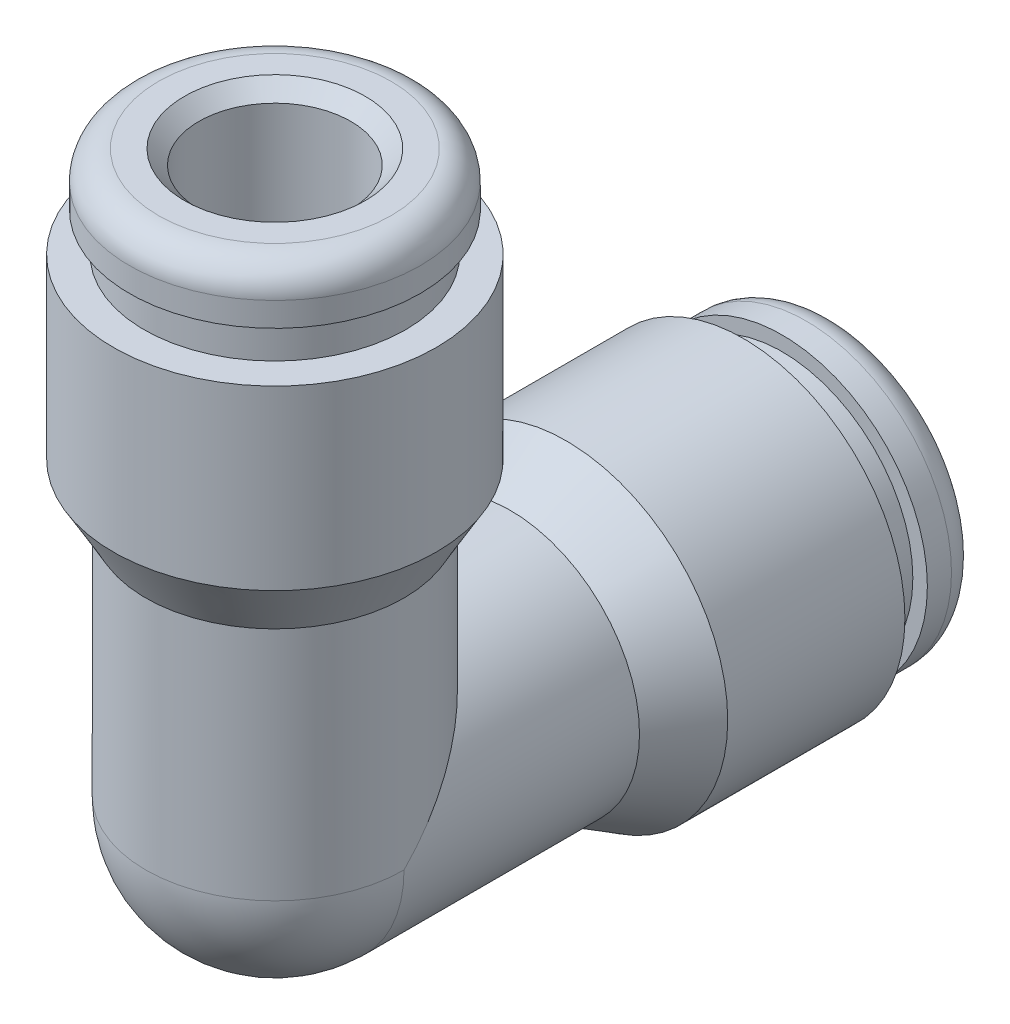
from build123d import *

# Parameters (mm, degrees)
CIRPATTERN1_COUNT = 2
CIRPATTERN1_ANGLE = 90
REVOLVE2_ANGLE    = 90
CIRPATTERN2_COUNT = 2
CIRPATTERN2_ANGLE = 90


with BuildPart() as part:
    # Sketch1 → Revolve1 (revolve)
    with BuildSketch(Plane(origin=(0, 0, 0), x_dir=(0, 0, -1), z_dir=(1, 0, 0)), mode=Mode.PRIVATE) as revolve1_sk:
        with BuildLine():
            Line((13.353, 3.825), (13.988, 3.825))
            ThreePointArc((13.988, 3.825), (14.526815367, 3.601815367), (14.75, 3.063))
            Line((14.75, 3.063), (14.75, 2.381))
            Line((14.75, 2.381), (14.369, 2))
            Line((14.369, 2), (5.25, 2))
            Line((5.25, 2), (5.25, 1.238))
            Line((5.25, 1.238), (0, 1.238))
            Line((0, 1.238), (0, 3.4))
            Line((0, 3.4), (6.2, 3.4))
            Line((6.2, 3.4), (7.672243186, 4.25))
            Line((7.672243186, 4.25), (12.337, 4.25))
            Line((12.337, 4.25), (12.337, 3.4425))
            Line((12.337, 3.4425), (13.353, 3.4425))
            Line((13.353, 3.4425), (13.353, 3.825))
        make_face()
    revolve(revolve1_sk.sketch.rotate(Axis((0, 0, 0), (0, 0, -1)), 90), axis=Axis((0, 0, 0), (0, 0, -1)))


with BuildPart() as cirpattern1_1:
    # CirPattern1: pattern copy
    add(part.part.rotate(Axis((-15.801937006, 0, 0), (1, 0, 0)), 1 * CIRPATTERN1_ANGLE / (CIRPATTERN1_COUNT - 1)))


with BuildPart() as part_1:
    add(part.part)

    # Sketch2 → Revolve2 (revolve)
    with BuildSketch(Plane.XY):
        with BuildLine():
            Line((-3.4, 0), (-1.238, 0))
            ThreePointArc((-1.238, 0), (0, -1.238), (1.238, 0))
            Line((1.238, 0), (3.4, 0))
            ThreePointArc((3.4, 0), (0, -3.4), (-3.4, 0))
        make_face()
    revolve(axis=Axis((-3.4, 0, 0), (-1, 0, 0)), revolution_arc=REVOLVE2_ANGLE)

    # Combine1: union CirPattern1_1
    add(cirpattern1_1.part)

    # Sketch3 → Cut-Revolve1 (revolve, cut)
    with BuildSketch(Plane(origin=(0, 0, 0), x_dir=(0, 0, -1), z_dir=(1, 0, 0)), mode=Mode.PRIVATE) as cut_revolve1_sk:
        Polygon((14.75, 2.381), (14.369, 2), (5.25, 2), (5.25, 1.238), (0, 1.238), (0, 0), (14.75, 0), align=None)
    cut_revolve1 = revolve(cut_revolve1_sk.sketch.rotate(Axis((0, 0, 0), (0, 0, -1)), 90), axis=Axis((0, 0, 0), (0, 0, -1)), mode=Mode.SUBTRACT)

    # CirPattern2: Cut-Revolve1 ×2 about axis
    cirpattern2_axis = Axis((-15.801937006, 0, 0), (1, 0, 0))
    for i in range(1, CIRPATTERN2_COUNT):
        add(cut_revolve1.rotate(cirpattern2_axis, i * CIRPATTERN2_ANGLE / (CIRPATTERN2_COUNT - 1)), mode=Mode.SUBTRACT)


solid = part_1.part
